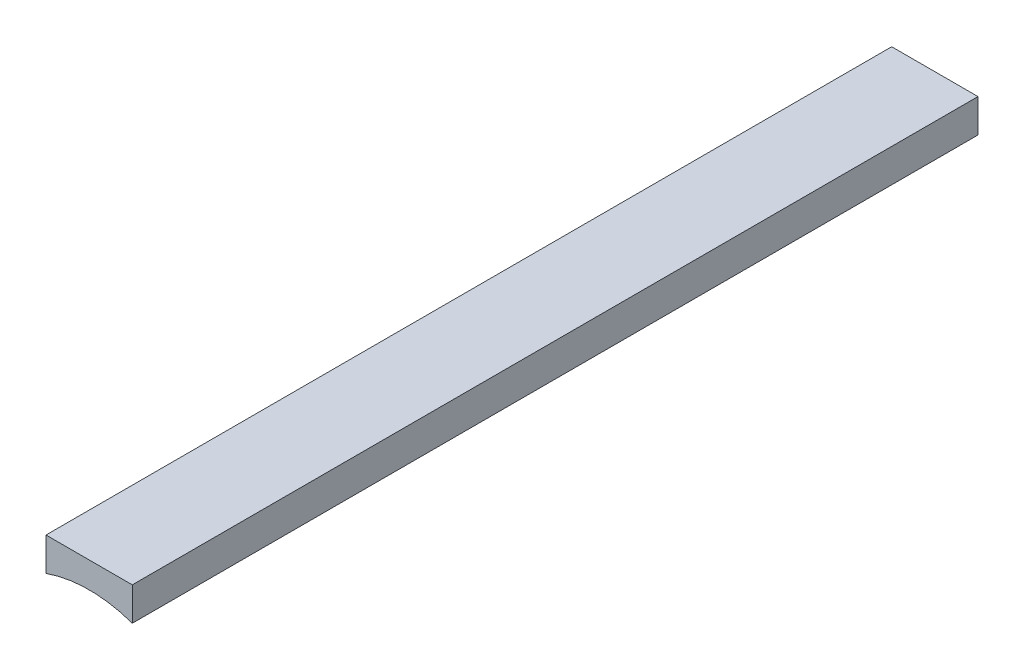
from build123d import *

# Parameters (mm, degrees)
BOSS_EXTRUDE1_DEPTH = 98


with BuildPart() as part:
    # Sketch1 → Boss-Extrude1 (new body)
    with BuildSketch(Plane.XY):
        with BuildLine():
            Line((-5, 18), (5, 18))
            Line((5, 18), (5, 14.142135624))
            ThreePointArc((5, 14.142135624), (0, 15), (-5, 14.142135624))
            Line((-5, 14.142135624), (-5, 18))
        make_face()
    extrude(amount=BOSS_EXTRUDE1_DEPTH)


solid = part.part
